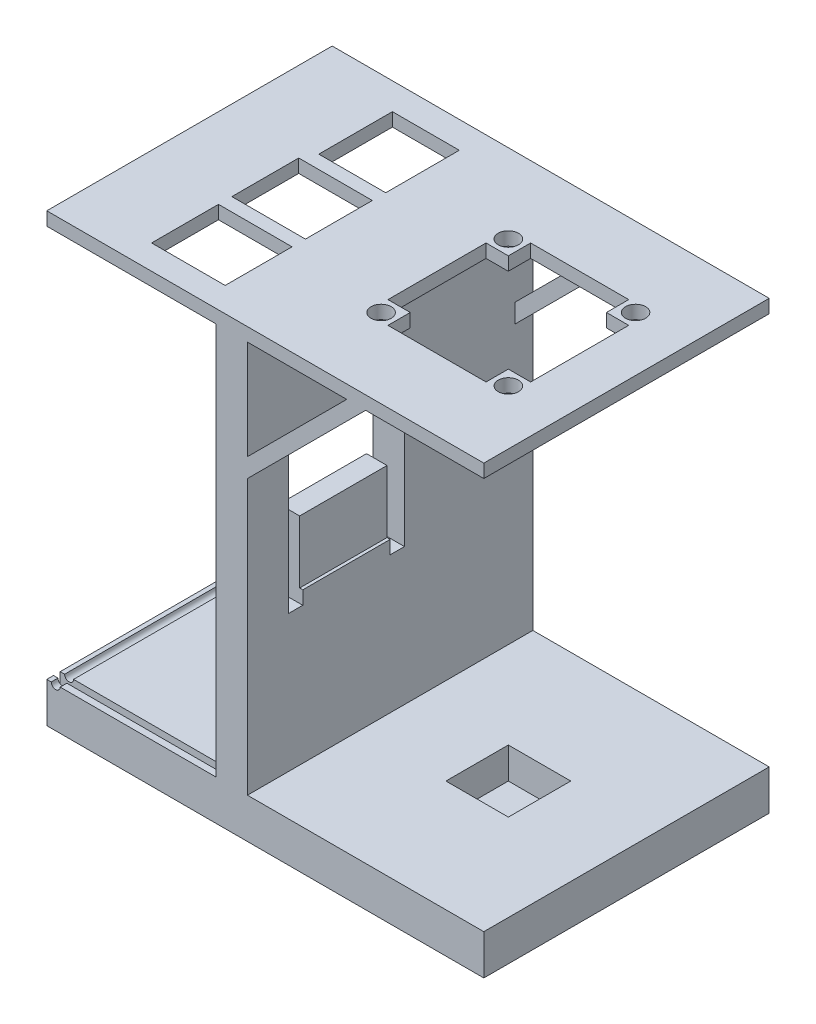
from build123d import *

# Parameters (mm, degrees)
EXTRUDE_2_DEPTH           = 31
SKETCH_2_W                = 8
SKETCH_2_H                = 8
CUT_EXTRUDE_1_DEPTH       = 4
EXTRUDE_4_DEPTH           = 3
EXTRUDE_5_DEPTH           = 3
SKETCH_10_W               = 22
SKETCH_10_H               = 11
CUT_EXTRUDE_2_DEPTH       = 118.345643294
SKETCH_11_W               = 0.7
SKETCH_11_H               = 28
CUT_EXTRUDE_3_DEPTH       = 118.345643294
SKETCH_12_W               = 0.7
SKETCH_12_H               = 28
CUT_EXTRUDE_4_DEPTH       = 118.345643294
SKETCH_13_W               = 20.6
SKETCH_13_H               = 11
CUT_EXTRUDE_6_DEPTH       = 0.7
SKETCH_15_W               = 20.6
SKETCH_15_H               = 14
CUT_EXTRUDE_7_DEPTH       = 0.7
SKETCH_17_W               = 15
SKETCH_17_H               = 15
CUT_EXTRUDE_8_DEPTH       = 129.883668477
SKETCH_18_W               = 62
SKETCH_18_H               = 3
EXTRUDE_6_DEPTH           = 3
SKETCH_20_W               = 62
SKETCH_20_H               = 9
EXTRUDE_7_DEPTH           = 3
SKETCH_22_W               = 15
SKETCH_22_H               = 15
CUT_EXTRUDE_10_DEPTH      = 129.883668477
SKETCH_23_W               = 13.5
SKETCH_23_H               = 16.5
CUT_EXTRUDE_11_DEPTH      = 129.883668477
SKETCH_26_W               = 32
SKETCH_26_H               = 22
CUT_EXTRUDE_14_DEPTH      = 129.883668477
SKETCH_29_W               = 22
SKETCH_29_H               = 32
CUT_EXTRUDE_15_DEPTH      = 129.883668477
CUT_EXTRUDE_16_REACH      = 133.156
SKETCH_30_R               = 1.263405553
SKETCH_31_W               = 25
SKETCH_31_H               = 1.5
CUT_EXTRUDE_18_DEPTH      = 3
SKETCH_32_W               = 3
SKETCH_32_H               = 1.5
CUT_EXTRUDE_19_DEPTH      = 88
SKETCH_33_W               = 3
SKETCH_33_H               = 1.5
CUT_EXTRUDE_20_DEPTH      = 17
SKETCH_34_W               = 1.5
SKETCH_34_H               = 43.313673025
CUT_EXTRUDE_21_DEPTH      = 3
SKETCH_35_R               = 1
CUT_EXTRUDE_23_DEPTH      = 142.721557993
SKETCH_39_R               = 2.265
CUT_EXTRUDE_24_DEPTH      = 10
SKETCH_40_W               = 15
SKETCH_40_H               = 3
CUT_EXTRUDE_25_DEPTH      = 1.5
SKETCH_41_W               = 15
SKETCH_41_H               = 3
CUT_EXTRUDE_26_DEPTH      = 1.5
SKETCH_42_W               = 16.5
SKETCH_42_H               = 3
CUT_EXTRUDE_27_DEPTH      = 1.5
SKETCH_43_W               = 7
SKETCH_43_H               = 28
CUT_EXTRUDE_28_DEPTH      = 1.5
CUT_EXTRUDE_29_DEPTH      = 1
SKETCH_45_W               = 19.6
SKETCH_45_H               = 11
CUT_EXTRUDE_30_DEPTH      = 1
EXTRUDE_8_DEPTH           = 1
EXTRUDE_START             = 1
EXTRUDE_9_DEPTH           = 1
EXTRUDE_10_DEPTH          = 1
CUT_EXTRUDE_31_DEPTH      = 1
EXTRUDE_11_DEPTH          = 1
SKETCH_51_W               = 3
SKETCH_51_H               = 43.313673025
CUT_EXTRUDE_32_DEPTH      = 1
SKETCH_52_W               = 3
SKETCH_52_H               = 43.313673025
EXTRUDE_12_DEPTH          = 1
CUT_EXTRUDE_START         = -1
CUT_EXTRUDE_33_DEPTH      = 1
EXTRUDE_13_DEPTH          = 1
SKETCH_56_W               = 64
SKETCH_56_H               = 3
EXTRUDE_14_DEPTH          = 1
EXTRUDE_15_DEPTH          = 1
CUT_EXTRUDE_34_DEPTH      = 12.1
SKETCH_60_W               = 7.5
SKETCH_60_H               = 40.1
CUT_EXTRUDE_35_DEPTH      = 118.613774703
EXTRUDE_16_DEPTH          = 7.5
CUT_EXTRUDE_37_DEPTH      = 7.5
SKETCH_63_W               = 6.2
SKETCH_63_H               = 0.313673025
CUT_EXTRUDE_38_DEPTH      = 120.469661421
SKETCH_66_W               = 7
SKETCH_66_H               = 40.1
CUT_EXTRUDE_39_DEPTH      = 3.2
EXTRUDE_17_DEPTH          = 3.2
CUT_EXTRUDE_40_DEPTH      = 3.2
EXTRUDE_18_DEPTH          = 48.2
SKETCH_71_W               = 4.6
SKETCH_71_H               = 19.6
EXTRUDE_19_DEPTH          = 14
SKETCH_72_W               = 0.7
SKETCH_72_H               = 19.6
EXTRUDE_20_DEPTH          = 14
SKETCH_73_W               = 1.7
SKETCH_73_H               = 19.6
EXTRUDE_21_DEPTH          = 14
SKETCH_74_W               = 7
SKETCH_74_H               = 26
CUT_EXTRUDE_41_DEPTH      = 5
SKETCH_75_W               = 7
SKETCH_75_H               = 26
CUT_EXTRUDE_42_DEPTH      = 2
SKETCH_76_W               = 7
SKETCH_76_H               = 3.2
EXTRUDE_22_DEPTH          = 14
SKETCH_77_W               = 7
SKETCH_77_H               = 3.2
EXTRUDE_23_DEPTH          = 14
CUT_EXTRUDE_43_DEPTH      = 143.16187956
CUT_EXTRUDE_43_DEPTH_BACK = 143.16187956
SKETCH_79_W               = 8
SKETCH_79_H               = 4
CUT_EXTRUDE_44_DEPTH      = 3
SKETCH_80_W               = 11
SKETCH_80_H               = 4
CUT_EXTRUDE_45_DEPTH      = 3
SKETCH_81_W               = 11
SKETCH_81_H               = 4
CUT_EXTRUDE_46_DEPTH      = 3
SKETCH_82_W               = 14
SKETCH_82_H               = 4
CUT_EXTRUDE_47_DEPTH      = 3
SKETCH_83_W               = 14
SKETCH_83_H               = 14
CUT_EXTRUDE_48_DEPTH      = 3
SKETCH_84_W               = 64
SKETCH_84_H               = 3
EXTRUDE_24_DEPTH          = 15
EXTRUDE_25_DEPTH          = 15
EXTRUDE_26_DEPTH          = 20
SKETCH_87_R               = 1
CUT_EXTRUDE_49_DEPTH      = 143.607853921


with BuildPart() as part:
    # 草图1 → 凸台-拉伸2 (new, symmetric)
    with BuildSketch(Plane.XY):
        Polygon((0, 0), (79, 0), (79, 9), (26, 9), (26, 97), (79, 97), (79, 100), (0, 100), (0, 97), (19, 97), (19, 9), (0, 9), align=None)
    extrude(amount=EXTRUDE_2_DEPTH, both=True)

    # 草图2 → 切除-拉伸1 (cut)
    with BuildSketch(Plane(origin=(0, 9, 0), x_dir=(1, 0, 0), z_dir=(0, 1, 0))):
        with Locations((52.5, 0)):
            Rectangle(SKETCH_2_W, SKETCH_2_H)
    extrude(amount=-CUT_EXTRUDE_1_DEPTH, mode=Mode.SUBTRACT)

    # 草图5 → 凸台-拉伸4 (add)
    with BuildSketch(Plane.XY.offset(31)):
        Polygon((26, 70.5), (26, 74.742640687), (48.257359313, 97), (52.5, 97), align=None)
    extrude(amount=-EXTRUDE_4_DEPTH)

    # 草图9 → 凸台-拉伸5 (add)
    with BuildSketch(Plane(origin=(0, 0, -31), x_dir=(-1, 0, 0), z_dir=(0, 0, -1))):
        Polygon((-52.5, 97), (-26, 70.5), (-26, 74.742640687), (-48.257359313, 97), align=None)
    extrude(amount=-EXTRUDE_5_DEPTH)

    # 草图10 → 切除-拉伸2 (cut, through all)
    with BuildSketch(Plane(origin=(26, 0, 0), x_dir=(0, 0, -1), z_dir=(1, 0, 0))):
        with Locations((-20, 48.186326975)):
            Rectangle(SKETCH_10_W, SKETCH_10_H)
    extrude(amount=-CUT_EXTRUDE_2_DEPTH, mode=Mode.SUBTRACT)

    # 草图11 → 切除-拉伸3 (cut, through all)
    with BuildSketch(Plane(origin=(26, 0, 0), x_dir=(0, 0, -1), z_dir=(1, 0, 0))):
        with Locations((-9.35, 39.686326975)):
            Rectangle(SKETCH_11_W, SKETCH_11_H)
    extrude(amount=-CUT_EXTRUDE_3_DEPTH, mode=Mode.SUBTRACT)

    # 草图12 → 切除-拉伸4 (cut, through all)
    with BuildSketch(Plane(origin=(26, 0, 0), x_dir=(0, 0, -1), z_dir=(1, 0, 0))):
        with Locations((-30.65, 39.686326975)):
            Rectangle(SKETCH_12_W, SKETCH_12_H)
    extrude(amount=-CUT_EXTRUDE_4_DEPTH, mode=Mode.SUBTRACT)

    # 草图13 → 切除-拉伸6 (cut)
    with BuildSketch(Plane.ZY.offset(-19)):
        with Locations((20, 37.186326975)):
            Rectangle(SKETCH_13_W, SKETCH_13_H)
    extrude(amount=-CUT_EXTRUDE_6_DEPTH, mode=Mode.SUBTRACT)

    # 草图15 → 切除-拉伸7 (cut)
    with BuildSketch(Plane(origin=(26, 0, 0), x_dir=(0, 0, -1), z_dir=(1, 0, 0))):
        with Locations((-20, 35.686326975)):
            Rectangle(SKETCH_15_W, SKETCH_15_H)
    extrude(amount=-CUT_EXTRUDE_7_DEPTH, mode=Mode.SUBTRACT)

    # 草图17 → 切除-拉伸8 (cut, through all)
    with BuildSketch(Plane.XZ.offset(-97)):
        with Locations((8, 19)):
            Rectangle(SKETCH_17_W, SKETCH_17_H)
    extrude(amount=-CUT_EXTRUDE_8_DEPTH, mode=Mode.SUBTRACT)

    # 草图18 → 凸台-拉伸6 (add)
    with BuildSketch(Plane.ZY):
        with Locations((0, 98.5)):
            Rectangle(SKETCH_18_W, SKETCH_18_H)
    extrude(amount=EXTRUDE_6_DEPTH)

    # 草图20 → 凸台-拉伸7 (add)
    with BuildSketch(Plane.ZY):
        with Locations((0, 4.5)):
            Rectangle(SKETCH_20_W, SKETCH_20_H)
    extrude(amount=EXTRUDE_7_DEPTH)

    # 草图22 → 切除-拉伸10 (cut, through all)
    with BuildSketch(Plane.XZ.offset(-97)):
        with Locations((8, 1)):
            Rectangle(SKETCH_22_W, SKETCH_22_H)
    extrude(amount=-CUT_EXTRUDE_10_DEPTH, mode=Mode.SUBTRACT)

    # 草图23 → 切除-拉伸11 (cut, through all)
    with BuildSketch(Plane.XZ.offset(-97)):
        with Locations((8.75, -17.75)):
            Rectangle(SKETCH_23_W, SKETCH_23_H)
    extrude(amount=-CUT_EXTRUDE_11_DEPTH, mode=Mode.SUBTRACT)

    # 草图26 → 切除-拉伸14 (cut, through all)
    with BuildSketch(Plane.XZ.offset(-97)):
        with Locations((52.5, 0)):
            Rectangle(SKETCH_26_W, SKETCH_26_H)
    extrude(amount=-CUT_EXTRUDE_14_DEPTH, mode=Mode.SUBTRACT)

    # 草图29 → 切除-拉伸15 (cut, through all)
    with BuildSketch(Plane.XZ.offset(-97)):
        with Locations((52.5, 0)):
            Rectangle(SKETCH_29_W, SKETCH_29_H)
    extrude(amount=-CUT_EXTRUDE_15_DEPTH, mode=Mode.SUBTRACT)

    # 草图30 → 切除-拉伸16 (cut, up to next)
    with BuildSketch(Plane(origin=(0, 100, 0), x_dir=(1, 0, 0), z_dir=(0, 1, 0)), mode=Mode.PRIVATE) as cut_extrude_16_sk1:
        with Locations((38.236594447, -14.263405553)):
            Circle(SKETCH_30_R)
    cut_extrude_16_tool1 = extrude(cut_extrude_16_sk1.sketch, amount=-CUT_EXTRUDE_16_REACH, mode=Mode.PRIVATE) & part.part
    # 草图30 → 切除-拉伸16 (cut, up to next)
    with BuildSketch(Plane(origin=(0, 100, 0), x_dir=(1, 0, 0), z_dir=(0, 1, 0)), mode=Mode.PRIVATE) as cut_extrude_16_sk2:
        with Locations((66.763405553, -14.263405553)):
            Circle(SKETCH_30_R)
    cut_extrude_16_tool2 = extrude(cut_extrude_16_sk2.sketch, amount=-CUT_EXTRUDE_16_REACH, mode=Mode.PRIVATE) & part.part
    # 草图30 → 切除-拉伸16 (cut, up to next)
    with BuildSketch(Plane(origin=(0, 100, 0), x_dir=(1, 0, 0), z_dir=(0, 1, 0)), mode=Mode.PRIVATE) as cut_extrude_16_sk3:
        with Locations((66.763405553, 14.263405553)):
            Circle(SKETCH_30_R)
    cut_extrude_16_tool3 = extrude(cut_extrude_16_sk3.sketch, amount=-CUT_EXTRUDE_16_REACH, mode=Mode.PRIVATE) & part.part
    # 草图30 → 切除-拉伸16 (cut, up to next)
    with BuildSketch(Plane(origin=(0, 100, 0), x_dir=(1, 0, 0), z_dir=(0, 1, 0)), mode=Mode.PRIVATE) as cut_extrude_16_sk4:
        with Locations((38.236594447, 14.263405553)):
            Circle(SKETCH_30_R)
    cut_extrude_16_tool4 = extrude(cut_extrude_16_sk4.sketch, amount=-CUT_EXTRUDE_16_REACH, mode=Mode.PRIVATE) & part.part
    add(cut_extrude_16_tool1.solids().sort_by_distance((38.236594, 100, 14.263406))[0], mode=Mode.SUBTRACT)
    add(cut_extrude_16_tool2.solids().sort_by_distance((66.763406, 100, 14.263406))[0], mode=Mode.SUBTRACT)
    add(cut_extrude_16_tool3.solids().sort_by_distance((66.763406, 100, -14.263406))[0], mode=Mode.SUBTRACT)
    add(cut_extrude_16_tool4.solids().sort_by_distance((38.236594, 100, -14.263406))[0], mode=Mode.SUBTRACT)

    # 草图31 → 切除-拉伸18 (cut)
    with BuildSketch(Plane(origin=(0, 9, 0), x_dir=(1, 0, 0), z_dir=(0, 1, 0))):
        with Locations((9.5, 28.75)):
            Rectangle(SKETCH_31_W, SKETCH_31_H)
        with Locations((9.5, -28.75)):
            Rectangle(SKETCH_31_W, SKETCH_31_H)
    extrude(amount=-CUT_EXTRUDE_18_DEPTH, mode=Mode.SUBTRACT)

    # 草图32 → 切除-拉伸19 (cut)
    with BuildSketch(Plane.XZ.offset(-9)):
        with Locations((20.5, -28.75)):
            Rectangle(SKETCH_32_W, SKETCH_32_H)
    extrude(amount=-CUT_EXTRUDE_19_DEPTH, mode=Mode.SUBTRACT)

    # 草图33 → 切除-拉伸20 (cut)
    with BuildSketch(Plane.XZ.offset(-9)):
        with Locations((20.5, 28.75)):
            Rectangle(SKETCH_33_W, SKETCH_33_H)
    extrude(amount=-CUT_EXTRUDE_20_DEPTH, mode=Mode.SUBTRACT)

    # 草图34 → 切除-拉伸21 (cut)
    with BuildSketch(Plane.ZY.offset(-19)):
        with Locations((28.75, 75.343163487)):
            Rectangle(SKETCH_34_W, SKETCH_34_H)
    extrude(amount=-CUT_EXTRUDE_21_DEPTH, mode=Mode.SUBTRACT)

    # 草图35 → 切除-拉伸23 (cut, through all)
    with BuildSketch(Plane.XY.offset(31)):
        with Locations((-1, 9)):
            Circle(SKETCH_35_R)
    extrude(amount=-CUT_EXTRUDE_23_DEPTH, mode=Mode.SUBTRACT)

    # 草图39 → 切除-拉伸24 (cut)
    with BuildSketch(Plane(origin=(0, 100, 0), x_dir=(1, 0, 0), z_dir=(0, 1, 0))):
        with Locations((66.763405553, -14.263405553)):
            Circle(SKETCH_39_R)
        with Locations((38.236594447, -14.263405553)):
            Circle(SKETCH_39_R)
        with Locations((66.763405553, 14.263405553)):
            Circle(SKETCH_39_R)
        with Locations((38.236594447, 14.263405553)):
            Circle(SKETCH_39_R)
    extrude(amount=-CUT_EXTRUDE_24_DEPTH, mode=Mode.SUBTRACT)

    # 草图40 → 切除-拉伸25 (cut)
    with BuildSketch(Plane(origin=(0.5, 0, 0), x_dir=(0, 0, -1), z_dir=(1, 0, 0))):
        with Locations((-19, 98.5)):
            Rectangle(SKETCH_40_W, SKETCH_40_H)
    extrude(amount=-CUT_EXTRUDE_25_DEPTH, mode=Mode.SUBTRACT)

    # 草图41 → 切除-拉伸26 (cut)
    with BuildSketch(Plane(origin=(0.5, 0, 0), x_dir=(0, 0, -1), z_dir=(1, 0, 0))):
        with Locations((-1, 98.5)):
            Rectangle(SKETCH_41_W, SKETCH_41_H)
    extrude(amount=-CUT_EXTRUDE_26_DEPTH, mode=Mode.SUBTRACT)

    # 草图42 → 切除-拉伸27 (cut)
    with BuildSketch(Plane(origin=(2, 0, 0), x_dir=(0, 0, -1), z_dir=(1, 0, 0))):
        with Locations((17.75, 98.5)):
            Rectangle(SKETCH_42_W, SKETCH_42_H)
    extrude(amount=-CUT_EXTRUDE_27_DEPTH, mode=Mode.SUBTRACT)

    # 草图43 → 切除-拉伸28 (cut)
    with BuildSketch(Plane.XY.offset(9)):
        with Locations((22.5, 39.686326975)):
            Rectangle(SKETCH_43_W, SKETCH_43_H)
    extrude(amount=-CUT_EXTRUDE_28_DEPTH, mode=Mode.SUBTRACT)

    # 草图44 → 切除-拉伸29 (cut)
    with BuildSketch(Plane(origin=(0, 0, 9.7), x_dir=(-1, 0, 0), z_dir=(0, 0, -1))):
        Polygon((-25.3, 42.686326975), (-25.3, 28.686326975), (-26, 28.686326975), (-26, 25.686326975), (-19, 25.686326975), (-19, 31.686326975), (-19.7, 31.686326975), (-19.7, 42.686326975), align=None)
    extrude(amount=-CUT_EXTRUDE_29_DEPTH, mode=Mode.SUBTRACT)

    # 草图45 → 切除-拉伸30 (cut)
    with BuildSketch(Plane.ZY.offset(-19.7)):
        with Locations((20.5, 37.186326975)):
            Rectangle(SKETCH_45_W, SKETCH_45_H)
    extrude(amount=-CUT_EXTRUDE_30_DEPTH, mode=Mode.SUBTRACT)

    # 草图46 → 凸台-拉伸8 (add)
    with BuildSketch(Plane.XY.offset(31)):
        Polygon((19, 53.686326975), (26, 53.686326975), (26, 70.5), (52.5, 97), (79, 97), (79, 100), (-3, 100), (-3, 97), (19, 97), align=None)
    extrude(amount=EXTRUDE_8_DEPTH)

    # 草图47 → 凸台-拉伸9 (add)
    with BuildSketch(Plane.XY.offset(31).offset(EXTRUDE_START)):
        with BuildLine():
            Line((-2, 9), (-3, 9))
            Line((-3, 9), (-3, 0))
            Line((-3, 0), (79, 0))
            Line((79, 0), (79, 9))
            Line((79, 9), (26, 9))
            Line((26, 9), (26, 25.686326975))
            Line((26, 25.686326975), (19, 25.686326975))
            Line((19, 25.686326975), (19, 9))
            Line((19, 9), (0, 9))
            ThreePointArc((0, 9), (-1, 8), (-2, 9))
        make_face()
    extrude(amount=-EXTRUDE_9_DEPTH)

    # 草图48 → 凸台-拉伸10 (add)
    with BuildSketch(Plane(origin=(0, 0, -31), x_dir=(-1, 0, 0), z_dir=(0, 0, -1))):
        with BuildLine():
            Line((3, 9), (2, 9))
            ThreePointArc((2, 9), (1, 8), (0, 9))
            Line((0, 9), (-19, 9))
            Line((-19, 9), (-19, 97))
            Line((-19, 97), (3, 97))
            Line((3, 97), (3, 100))
            Line((3, 100), (-79, 100))
            Line((-79, 100), (-79, 97))
            Line((-79, 97), (-52.5, 97))
            Line((-52.5, 97), (-26, 70.5))
            Line((-26, 70.5), (-26, 9))
            Line((-26, 9), (-79, 9))
            Line((-79, 9), (-79, 0))
            Line((-79, 0), (3, 0))
            Line((3, 0), (3, 9))
        make_face()
    extrude(amount=EXTRUDE_10_DEPTH)

    # 草图49 → 切除-拉伸31 (cut)
    with BuildSketch(Plane.XY.offset(-29.5)):
        with BuildLine():
            Line((19, 9), (0, 9))
            ThreePointArc((0, 9), (-1, 8), (-2, 9))
            Line((-2, 9), (-3, 9))
            Line((-3, 9), (-3, 6))
            Line((-3, 6), (22, 6))
            Line((22, 6), (22, 97))
            Line((22, 97), (19, 97))
            Line((19, 97), (19, 9))
        make_face()
    extrude(amount=-CUT_EXTRUDE_31_DEPTH, mode=Mode.SUBTRACT)

    # 草图50 → 凸台-拉伸11 (add)
    with BuildSketch(Plane(origin=(0, 0, -28), x_dir=(-1, 0, 0), z_dir=(0, 0, -1))):
        with BuildLine():
            Line((3, 9), (2, 9))
            ThreePointArc((2, 9), (1, 8), (0, 9))
            Line((0, 9), (-19, 9))
            Line((-19, 9), (-19, 97))
            Line((-19, 97), (-22, 97))
            Line((-22, 97), (-22, 6))
            Line((-22, 6), (3, 6))
            Line((3, 6), (3, 9))
        make_face()
    extrude(amount=EXTRUDE_11_DEPTH)

    # 草图51 → 切除-拉伸32 (cut)
    with BuildSketch(Plane(origin=(0, 0, 29.5), x_dir=(-1, 0, 0), z_dir=(0, 0, -1))):
        with Locations((-20.5, 75.343163487)):
            Rectangle(SKETCH_51_W, SKETCH_51_H)
    extrude(amount=-CUT_EXTRUDE_32_DEPTH, mode=Mode.SUBTRACT)

    # 草图52 → 凸台-拉伸12 (add)
    with BuildSketch(Plane.XY.offset(28)):
        with Locations((20.5, 75.343163487)):
            Rectangle(SKETCH_52_W, SKETCH_52_H)
    extrude(amount=EXTRUDE_12_DEPTH)

    # 草图53 → 切除-拉伸33 (cut)
    with BuildSketch(Plane(origin=(0, 0, 29.5), x_dir=(-1, 0, 0), z_dir=(0, 0, -1)).offset(CUT_EXTRUDE_START)):
        with BuildLine():
            Line((3, 9), (2, 9))
            ThreePointArc((2, 9), (1, 8), (0, 9))
            Line((0, 9), (-19, 9))
            Line((-19, 9), (-19, 26))
            Line((-19, 26), (-22, 26))
            Line((-22, 26), (-22, 6))
            Line((-22, 6), (3, 6))
            Line((3, 6), (3, 9))
        make_face()
    extrude(amount=CUT_EXTRUDE_33_DEPTH, mode=Mode.SUBTRACT)

    # 草图54 → 凸台-拉伸13 (add)
    with BuildSketch(Plane.XY.offset(28).offset(EXTRUDE_START)):
        with BuildLine():
            Line((19, 9), (0, 9))
            ThreePointArc((0, 9), (-1, 8), (-2, 9))
            Line((-2, 9), (-3, 9))
            Line((-3, 9), (-3, 6))
            Line((-3, 6), (22, 6))
            Line((22, 6), (22, 26))
            Line((22, 26), (19, 26))
            Line((19, 26), (19, 9))
        make_face()
    extrude(amount=-EXTRUDE_13_DEPTH)

    # 草图56 → 凸台-拉伸14 (add)
    with BuildSketch(Plane.ZY.offset(3)):
        with Locations((0, 98.5)):
            Rectangle(SKETCH_56_W, SKETCH_56_H)
    extrude(amount=EXTRUDE_14_DEPTH)

    # 草图57 → 凸台-拉伸15 (add)
    with BuildSketch(Plane.ZY.offset(3)):
        Polygon((29, 6), (29, 9), (-29, 9), (-29, 6), (-30.5, 6), (-30.5, 9), (-32, 9), (-32, 0), (32, 0), (32, 9), (30.5, 9), (30.5, 6), align=None)
    extrude(amount=EXTRUDE_15_DEPTH)

    # 草图59 → 切除-拉伸34 (cut)
    with BuildSketch(Plane.XZ.offset(-53.686326975)):
        Polygon((22, 29), (19, 29), (19, 7.5), (26, 7.5), (26, 32), (19, 32), (19, 30.5), (22, 30.5), align=None)
    extrude(amount=-CUT_EXTRUDE_34_DEPTH, mode=Mode.SUBTRACT)

    # 草图60 → 切除-拉伸35 (cut, through all)
    with BuildSketch(Plane(origin=(26, 0, 0), x_dir=(0, 0, -1), z_dir=(1, 0, 0))):
        with Locations((-3.75, 45.736326975)):
            Rectangle(SKETCH_60_W, SKETCH_60_H)
    extrude(amount=-CUT_EXTRUDE_35_DEPTH, mode=Mode.SUBTRACT)

    # 草图61 → 凸台-拉伸16 (add)
    with BuildSketch(Plane(origin=(0, 0, 10.7), x_dir=(-1, 0, 0), z_dir=(0, 0, -1))):
        Polygon((-19, 31.686326975), (-20.7, 31.686326975), (-20.7, 42.686326975), (-25.3, 42.686326975), (-25.3, 28.686326975), (-26, 28.686326975), (-26, 25.686326975), (-19, 25.686326975), align=None)
    extrude(amount=EXTRUDE_16_DEPTH)

    # 草图62 → 切除-拉伸37 (cut)
    with BuildSketch(Plane.XY.offset(30.3)):
        Polygon((19, 26), (22, 26), (22, 25.686326975), (26, 25.686326975), (26, 28.686326975), (25.3, 28.686326975), (25.3, 42.686326975), (20.7, 42.686326975), (20.7, 31.686326975), (19, 31.686326975), align=None)
    extrude(amount=-CUT_EXTRUDE_37_DEPTH, mode=Mode.SUBTRACT)

    # 草图63 → 切除-拉伸38 (cut, through all)
    with BuildSketch(Plane(origin=(22, 0, 0), x_dir=(0, 0, -1), z_dir=(1, 0, 0))):
        with Locations((-25.9, 25.843163488)):
            Rectangle(SKETCH_63_W, SKETCH_63_H)
    extrude(amount=-CUT_EXTRUDE_38_DEPTH, mode=Mode.SUBTRACT)

    # 草图66 → 切除-拉伸39 (cut)
    with BuildSketch(Plane.XY):
        with Locations((22.5, 45.736326975)):
            Rectangle(SKETCH_66_W, SKETCH_66_H)
    extrude(amount=-CUT_EXTRUDE_39_DEPTH, mode=Mode.SUBTRACT)

    # 草图67 → 凸台-拉伸17 (add)
    with BuildSketch(Plane(origin=(0, 0, 3.2), x_dir=(-1, 0, 0), z_dir=(0, 0, -1))):
        Polygon((-19, 25.686326975), (-19, 31.686326975), (-20.7, 31.686326975), (-20.7, 42.686326975), (-25.3, 42.686326975), (-25.3, 28.686326975), (-26, 28.686326975), (-26, 25.686326975), align=None)
    extrude(amount=EXTRUDE_17_DEPTH)

    # 草图68 → 切除-拉伸40 (cut)
    with BuildSketch(Plane.XY.offset(22.8)):
        Polygon((19, 31.686326975), (19, 25.686326975), (26, 25.686326975), (26, 28.686326975), (25.3, 28.686326975), (25.3, 42.686326975), (20.7, 42.686326975), (20.7, 31.686326975), align=None)
    extrude(amount=-CUT_EXTRUDE_40_DEPTH, mode=Mode.SUBTRACT)

    # 草图70 → 凸台-拉伸18 (add)
    with BuildSketch(Plane(origin=(0, 25.686326975, 0), x_dir=(1, 0, 0), z_dir=(0, 1, 0))):
        Polygon((19, -22.8), (26, -22.8), (26, -32), (19, -32), (19, -30.5), (22, -30.5), (22, -29), (19, -29), align=None)
    extrude(amount=EXTRUDE_18_DEPTH)

    # 草图71 → 凸台-拉伸19 (add)
    with BuildSketch(Plane(origin=(0, 42.686326975, 0), x_dir=(1, 0, 0), z_dir=(0, 1, 0))):
        with Locations((23, -9.8)):
            Rectangle(SKETCH_71_W, SKETCH_71_H)
    extrude(amount=EXTRUDE_19_DEPTH)

    # 草图72 → 凸台-拉伸20 (add)
    with BuildSketch(Plane(origin=(0, 28.686326975, 0), x_dir=(1, 0, 0), z_dir=(0, 1, 0))):
        with Locations((25.65, -9.8)):
            Rectangle(SKETCH_72_W, SKETCH_72_H)
    extrude(amount=EXTRUDE_20_DEPTH)

    # 草图73 → 凸台-拉伸21 (add)
    with BuildSketch(Plane(origin=(0, 31.686326975, 0), x_dir=(1, 0, 0), z_dir=(0, 1, 0))):
        with Locations((19.85, -9.8)):
            Rectangle(SKETCH_73_W, SKETCH_73_H)
    extrude(amount=EXTRUDE_21_DEPTH)

    # 草图74 → 切除-拉伸41 (cut)
    with BuildSketch(Plane.XZ.offset(-65.786326975)):
        with Locations((22.5, 9.8)):
            Rectangle(SKETCH_74_W, SKETCH_74_H)
    extrude(amount=-CUT_EXTRUDE_41_DEPTH, mode=Mode.SUBTRACT)

    # 草图75 → 切除-拉伸42 (cut)
    with BuildSketch(Plane.XZ.offset(-70.786326975)):
        with Locations((22.5, 9.8)):
            Rectangle(SKETCH_75_W, SKETCH_75_H)
    extrude(amount=-CUT_EXTRUDE_42_DEPTH, mode=Mode.SUBTRACT)

    # 草图76 → 凸台-拉伸22 (add)
    with BuildSketch(Plane(origin=(0, 25.686326975, 0), x_dir=(1, 0, 0), z_dir=(0, 1, 0))):
        with Locations((22.5, 1.6)):
            Rectangle(SKETCH_76_W, SKETCH_76_H)
    extrude(amount=EXTRUDE_22_DEPTH)

    # 草图77 → 凸台-拉伸23 (add)
    with BuildSketch(Plane(origin=(0, 25.686326975, 0), x_dir=(1, 0, 0), z_dir=(0, 1, 0))):
        with Locations((22.5, -21.2)):
            Rectangle(SKETCH_77_W, SKETCH_77_H)
    extrude(amount=EXTRUDE_23_DEPTH)

    # 草图78 → 切除-拉伸43 (cut, two sides: drawn at the far end of the back side and taken through both)
    with BuildSketch(Plane(origin=(0, 0, 31), x_dir=(-1, 0, 0), z_dir=(0, 0, -1)).offset(-CUT_EXTRUDE_43_DEPTH_BACK)):
        Polygon((-48.257359313, 97), (-26, 74.742640687), (-26, 97), align=None)
    extrude(amount=CUT_EXTRUDE_43_DEPTH + CUT_EXTRUDE_43_DEPTH_BACK, mode=Mode.SUBTRACT)

    # 草图79 → 切除-拉伸44 (cut)
    with BuildSketch(Plane(origin=(48.5, 0, 0), x_dir=(0, 0, -1), z_dir=(1, 0, 0))):
        with Locations((0, 7)):
            Rectangle(SKETCH_79_W, SKETCH_79_H)
    extrude(amount=-CUT_EXTRUDE_44_DEPTH, mode=Mode.SUBTRACT)

    # 草图80 → 切除-拉伸45 (cut)
    with BuildSketch(Plane.XY.offset(-4)):
        with Locations((51, 7)):
            Rectangle(SKETCH_80_W, SKETCH_80_H)
    extrude(amount=-CUT_EXTRUDE_45_DEPTH, mode=Mode.SUBTRACT)

    # 草图81 → 切除-拉伸46 (cut)
    with BuildSketch(Plane(origin=(0, 0, 4), x_dir=(-1, 0, 0), z_dir=(0, 0, -1))):
        with Locations((-51, 7)):
            Rectangle(SKETCH_81_W, SKETCH_81_H)
    extrude(amount=-CUT_EXTRUDE_46_DEPTH, mode=Mode.SUBTRACT)

    # 草图82 → 切除-拉伸47 (cut)
    with BuildSketch(Plane.ZY.offset(-56.5)):
        with Locations((0, 7)):
            Rectangle(SKETCH_82_W, SKETCH_82_H)
    extrude(amount=-CUT_EXTRUDE_47_DEPTH, mode=Mode.SUBTRACT)

    # 草图83 → 切除-拉伸48 (cut)
    with BuildSketch(Plane(origin=(0, 5, 0), x_dir=(1, 0, 0), z_dir=(0, 1, 0))):
        with Locations((52.5, 0)):
            Rectangle(SKETCH_83_W, SKETCH_83_H)
    extrude(amount=-CUT_EXTRUDE_48_DEPTH, mode=Mode.SUBTRACT)

    # 草图84 → 凸台-拉伸24 (add)
    with BuildSketch(Plane.ZY.offset(4)):
        with Locations((0, 98.5)):
            Rectangle(SKETCH_84_W, SKETCH_84_H)
    extrude(amount=EXTRUDE_24_DEPTH)

    # 草图85 → 凸台-拉伸25 (add)
    with BuildSketch(Plane.ZY.offset(4)):
        Polygon((30.5, 6), (29, 6), (29, 9), (-29, 9), (-29, 6), (-30.5, 6), (-30.5, 9), (-32, 9), (-32, 0), (32, 0), (32, 9), (30.5, 9), align=None)
    extrude(amount=EXTRUDE_25_DEPTH)

    # 草图86 → 凸台-拉伸26 (add)
    with BuildSketch(Plane.ZY.offset(19)):
        Polygon((30.5, 9), (30.5, 6), (29, 6), (29, 9), (-29, 9), (-29, 6), (-30.5, 6), (-30.5, 9), (-32, 9), (-32, 0), (32, 0), (32, 9), align=None)
    extrude(amount=-EXTRUDE_26_DEPTH)

    # 草图87 → 切除-拉伸49 (cut, through all)
    with BuildSketch(Plane(origin=(0, 0, -32), x_dir=(-1, 0, 0), z_dir=(0, 0, -1))):
        with Locations((17, 9)):
            Circle(SKETCH_87_R)
    extrude(amount=-CUT_EXTRUDE_49_DEPTH, mode=Mode.SUBTRACT)


solid = part.part
